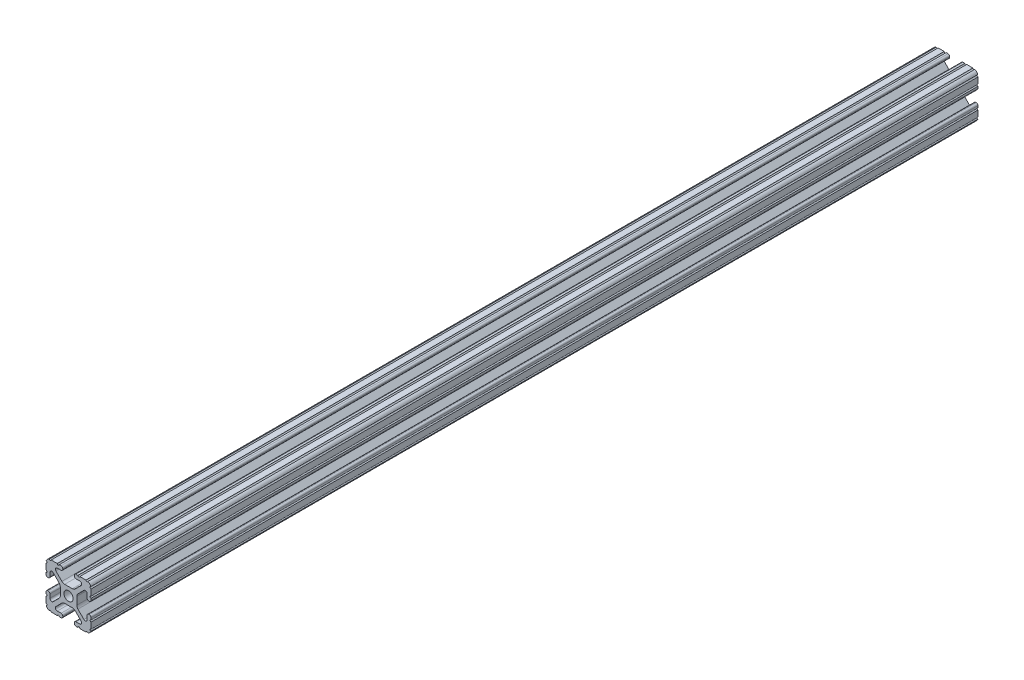
from build123d import *
from build123d.topology import SkipClean

# Parameters (mm, degrees)
BOSS_EXTRUDE1_DEPTH     = 76.2
CUT_EXTRUDE1_DEPTH      = 79.288057838
CUT_EXTRUDE1_DEPTH_BACK = 79.288057838
SKETCH5_R               = 0.55245
BOSS_EXTRUDE2_START     = 347.600199896
SKETCH6_R               = 2.6035
BOSS_EXTRUDE2_DEPTH     = 347.600199896


with BuildPart() as part:
    # Sketch4 → Boss-Extrude1 (new, symmetric)
    with BuildSketch(Plane.XY):
        with BuildLine():
            Line((4.190365, -12.7), (10.11729625, -12.7))
            ThreePointArc((10.11729625, -12.7), (11.943543585, -11.943543585), (12.7, -10.11729625))
            Line((12.7, -10.11729625), (12.7, -4.190365))
            ThreePointArc((12.7, -4.190365), (12.42492494, -3.52627506), (11.760835, -3.2512))
            Line((11.760835, -3.2512), (11.429365, -3.2512))
            ThreePointArc((11.429365, -3.2512), (10.76527506, -3.52627506), (10.4902, -4.190365))
            Line((10.4902, -4.190365), (10.4902, -6.348478019))
            ThreePointArc((10.4902, -6.348478019), (9.830707141, -7.335478831), (8.666460301, -7.103895736))
            Line((8.666460301, -7.103895736), (5.299899128, -3.737334563))
            ThreePointArc((5.299899128, -3.737334563), (4.817571085, -3.015479634), (4.6482, -2.16399369))
            Line((4.6482, -2.16399369), (4.6482, 0))
            Line((4.6482, 0), (2.6035, 0))
            ThreePointArc((2.6035, 0), (1.840952505, -1.840952505), (0, -2.6035))
            Line((0, -2.6035), (0, -4.6482))
            Line((0, -4.6482), (2.16399369, -4.6482))
            ThreePointArc((2.16399369, -4.6482), (3.015479634, -4.817571085), (3.737334563, -5.299899128))
            Line((3.737334563, -5.299899128), (7.103895736, -8.666460301))
            ThreePointArc((7.103895736, -8.666460301), (7.335478831, -9.830707141), (6.348478019, -10.4902))
            Line((6.348478019, -10.4902), (4.190365, -10.4902))
            ThreePointArc((4.190365, -10.4902), (3.52627506, -10.76527506), (3.2512, -11.429365))
            Line((3.2512, -11.429365), (3.2512, -11.760835))
            ThreePointArc((3.2512, -11.760835), (3.52627506, -12.42492494), (4.190365, -12.7))
        make_face()
    extrude(amount=BOSS_EXTRUDE1_DEPTH, both=True)

    # Sketch5 → Cut-Extrude1 (cut, two sides: drawn at the far end of the back side and taken through both)
    with BuildSketch(Plane.XY.offset(-CUT_EXTRUDE1_DEPTH_BACK)):
        with Locations((10.356153152, -12.7)):
            Circle(SKETCH5_R)
        with Locations((5.796028019, -12.7)):
            Circle(SKETCH5_R)
        with Locations((12.7, -10.356153152)):
            Circle(SKETCH5_R)
        with Locations((12.7, -5.796028019)):
            Circle(SKETCH5_R)
    extrude(amount=CUT_EXTRUDE1_DEPTH + CUT_EXTRUDE1_DEPTH_BACK, mode=Mode.SUBTRACT)

    # Mirror1: part across plane


with BuildPart() as part_1:
    add(part.part)
    add(part.part.mirror(Plane(origin=(0, 0, 0), x_dir=(0, 0, 1), z_dir=(1, 0, 0))))

    # Mirror2: part across plane


with BuildPart() as part_2:
    add(part_1.part)
    add(part_1.part.mirror(Plane.ZX))

    # Sketch6 → Boss-Extrude2 (add)
    with SkipClean():  # the faces are left unmerged after this step: merging them gives an invalid solid
        with BuildSketch(Plane.XY.offset(76.2).offset(BOSS_EXTRUDE2_START)):
            with BuildLine():
                Line((12.7, -5.243578019), (12.7, -4.190365))
                ThreePointArc((12.7, -4.190365), (12.42492494, -3.52627506), (11.760835, -3.2512))
                Line((11.760835, -3.2512), (11.429365, -3.2512))
                ThreePointArc((11.429365, -3.2512), (10.76527506, -3.52627506), (10.4902, -4.190365))
                Line((10.4902, -4.190365), (10.4902, -6.348478019))
                ThreePointArc((10.4902, -6.348478019), (9.830707141, -7.335478831), (8.666460301, -7.103895736))
                Line((8.666460301, -7.103895736), (5.299899128, -3.737334563))
                ThreePointArc((5.299899128, -3.737334563), (4.817571085, -3.015479634), (4.6482, -2.16399369))
                Line((4.6482, -2.16399369), (4.6482, 2.16399369))
                ThreePointArc((4.6482, 2.16399369), (4.817571085, 3.015479634), (5.299899128, 3.737334563))
                Line((5.299899128, 3.737334563), (8.666460301, 7.103895736))
                ThreePointArc((8.666460301, 7.103895736), (9.830707141, 7.335478831), (10.4902, 6.348478019))
                Line((10.4902, 6.348478019), (10.4902, 4.190365))
                ThreePointArc((10.4902, 4.190365), (10.76527506, 3.52627506), (11.429365, 3.2512))
                Line((11.429365, 3.2512), (11.760835, 3.2512))
                ThreePointArc((11.760835, 3.2512), (12.42492494, 3.52627506), (12.7, 4.190365))
                Line((12.7, 4.190365), (12.7, 5.243578019))
                ThreePointArc((12.7, 5.243578019), (12.14755, 5.796028019), (12.7, 6.348478019))
                Line((12.7, 6.348478019), (12.7, 9.803703152))
                ThreePointArc((12.7, 9.803703152), (12.150857656, 10.295790178), (12.579996867, 10.895412135))
                ThreePointArc((12.579996867, 10.895412135), (11.943543585, 11.943543585), (10.895412135, 12.579996867))
                ThreePointArc((10.895412135, 12.579996867), (10.295790178, 12.150857656), (9.803703152, 12.7))
                Line((9.803703152, 12.7), (6.348478019, 12.7))
                ThreePointArc((6.348478019, 12.7), (5.796028019, 12.14755), (5.243578019, 12.7))
                Line((5.243578019, 12.7), (4.190365, 12.7))
                ThreePointArc((4.190365, 12.7), (3.52627506, 12.42492494), (3.2512, 11.760835))
                Line((3.2512, 11.760835), (3.2512, 11.429365))
                ThreePointArc((3.2512, 11.429365), (3.52627506, 10.76527506), (4.190365, 10.4902))
                Line((4.190365, 10.4902), (6.348478019, 10.4902))
                ThreePointArc((6.348478019, 10.4902), (7.335478831, 9.830707141), (7.103895736, 8.666460301))
                Line((7.103895736, 8.666460301), (3.737334563, 5.299899128))
                ThreePointArc((3.737334563, 5.299899128), (3.015479634, 4.817571085), (2.16399369, 4.6482))
                Line((2.16399369, 4.6482), (-2.16399369, 4.6482))
                ThreePointArc((-2.16399369, 4.6482), (-3.015479634, 4.817571085), (-3.737334563, 5.299899128))
                Line((-3.737334563, 5.299899128), (-7.103895736, 8.666460301))
                ThreePointArc((-7.103895736, 8.666460301), (-7.335478831, 9.830707141), (-6.348478019, 10.4902))
                Line((-6.348478019, 10.4902), (-4.190365, 10.4902))
                ThreePointArc((-4.190365, 10.4902), (-3.52627506, 10.76527506), (-3.2512, 11.429365))
                Line((-3.2512, 11.429365), (-3.2512, 11.760835))
                ThreePointArc((-3.2512, 11.760835), (-3.52627506, 12.42492494), (-4.190365, 12.7))
                Line((-4.190365, 12.7), (-5.243578019, 12.7))
                ThreePointArc((-5.243578019, 12.7), (-5.796028019, 12.14755), (-6.348478019, 12.7))
                Line((-6.348478019, 12.7), (-9.803703152, 12.7))
                ThreePointArc((-9.803703152, 12.7), (-10.295790178, 12.150857656), (-10.895412135, 12.579996867))
                ThreePointArc((-10.895412135, 12.579996867), (-11.943543585, 11.943543585), (-12.579996867, 10.895412135))
                ThreePointArc((-12.579996867, 10.895412135), (-12.150857656, 10.295790178), (-12.7, 9.803703152))
                Line((-12.7, 9.803703152), (-12.7, 6.348478019))
                ThreePointArc((-12.7, 6.348478019), (-12.14755, 5.796028019), (-12.7, 5.243578019))
                Line((-12.7, 5.243578019), (-12.7, 4.190365))
                ThreePointArc((-12.7, 4.190365), (-12.42492494, 3.52627506), (-11.760835, 3.2512))
                Line((-11.760835, 3.2512), (-11.429365, 3.2512))
                ThreePointArc((-11.429365, 3.2512), (-10.76527506, 3.52627506), (-10.4902, 4.190365))
                Line((-10.4902, 4.190365), (-10.4902, 6.348478019))
                ThreePointArc((-10.4902, 6.348478019), (-9.830707141, 7.335478831), (-8.666460301, 7.103895736))
                Line((-8.666460301, 7.103895736), (-5.299899128, 3.737334563))
                ThreePointArc((-5.299899128, 3.737334563), (-4.817571085, 3.015479634), (-4.6482, 2.16399369))
                Line((-4.6482, 2.16399369), (-4.6482, -2.16399369))
                ThreePointArc((-4.6482, -2.16399369), (-4.817571085, -3.015479634), (-5.299899128, -3.737334563))
                Line((-5.299899128, -3.737334563), (-8.666460301, -7.103895736))
                ThreePointArc((-8.666460301, -7.103895736), (-9.830707141, -7.335478831), (-10.4902, -6.348478019))
                Line((-10.4902, -6.348478019), (-10.4902, -4.190365))
                ThreePointArc((-10.4902, -4.190365), (-10.76527506, -3.52627506), (-11.429365, -3.2512))
                Line((-11.429365, -3.2512), (-11.760835, -3.2512))
                ThreePointArc((-11.760835, -3.2512), (-12.42492494, -3.52627506), (-12.7, -4.190365))
                Line((-12.7, -4.190365), (-12.7, -5.243578019))
                ThreePointArc((-12.7, -5.243578019), (-12.14755, -5.796028019), (-12.7, -6.348478019))
                Line((-12.7, -6.348478019), (-12.7, -9.803703152))
                ThreePointArc((-12.7, -9.803703152), (-12.150857656, -10.295790178), (-12.579996867, -10.895412135))
                ThreePointArc((-12.579996867, -10.895412135), (-11.943543585, -11.943543585), (-10.895412135, -12.579996867))
                ThreePointArc((-10.895412135, -12.579996867), (-10.295790178, -12.150857656), (-9.803703152, -12.7))
                Line((-9.803703152, -12.7), (-6.348478019, -12.7))
                ThreePointArc((-6.348478019, -12.7), (-5.796028019, -12.14755), (-5.243578019, -12.7))
                Line((-5.243578019, -12.7), (-4.190365, -12.7))
                ThreePointArc((-4.190365, -12.7), (-3.52627506, -12.42492494), (-3.2512, -11.760835))
                Line((-3.2512, -11.760835), (-3.2512, -11.429365))
                ThreePointArc((-3.2512, -11.429365), (-3.52627506, -10.76527506), (-4.190365, -10.4902))
                Line((-4.190365, -10.4902), (-6.348478019, -10.4902))
                ThreePointArc((-6.348478019, -10.4902), (-7.335478831, -9.830707141), (-7.103895736, -8.666460301))
                Line((-7.103895736, -8.666460301), (-3.737334563, -5.299899128))
                ThreePointArc((-3.737334563, -5.299899128), (-3.015479634, -4.817571085), (-2.16399369, -4.6482))
                Line((-2.16399369, -4.6482), (2.16399369, -4.6482))
                ThreePointArc((2.16399369, -4.6482), (3.015479634, -4.817571085), (3.737334563, -5.299899128))
                Line((3.737334563, -5.299899128), (7.103895736, -8.666460301))
                ThreePointArc((7.103895736, -8.666460301), (7.335478831, -9.830707141), (6.348478019, -10.4902))
                Line((6.348478019, -10.4902), (4.190365, -10.4902))
                ThreePointArc((4.190365, -10.4902), (3.52627506, -10.76527506), (3.2512, -11.429365))
                Line((3.2512, -11.429365), (3.2512, -11.760835))
                ThreePointArc((3.2512, -11.760835), (3.52627506, -12.42492494), (4.190365, -12.7))
                Line((4.190365, -12.7), (5.243578019, -12.7))
                ThreePointArc((5.243578019, -12.7), (5.796028019, -12.14755), (6.348478019, -12.7))
                Line((6.348478019, -12.7), (9.803703152, -12.7))
                ThreePointArc((9.803703152, -12.7), (10.295790178, -12.150857656), (10.895412135, -12.579996867))
                ThreePointArc((10.895412135, -12.579996867), (11.943543585, -11.943543585), (12.579996867, -10.895412135))
                ThreePointArc((12.579996867, -10.895412135), (12.150857656, -10.295790178), (12.7, -9.803703152))
                Line((12.7, -9.803703152), (12.7, -6.348478019))
                ThreePointArc((12.7, -6.348478019), (12.14755, -5.796028019), (12.7, -5.243578019))
            make_face()
            with Locations(Location((0, 0, 0), (0, 0, 180))):
                Circle(SKETCH6_R, mode=Mode.SUBTRACT)
        extrude(amount=-BOSS_EXTRUDE2_DEPTH)


solid = part_2.part
